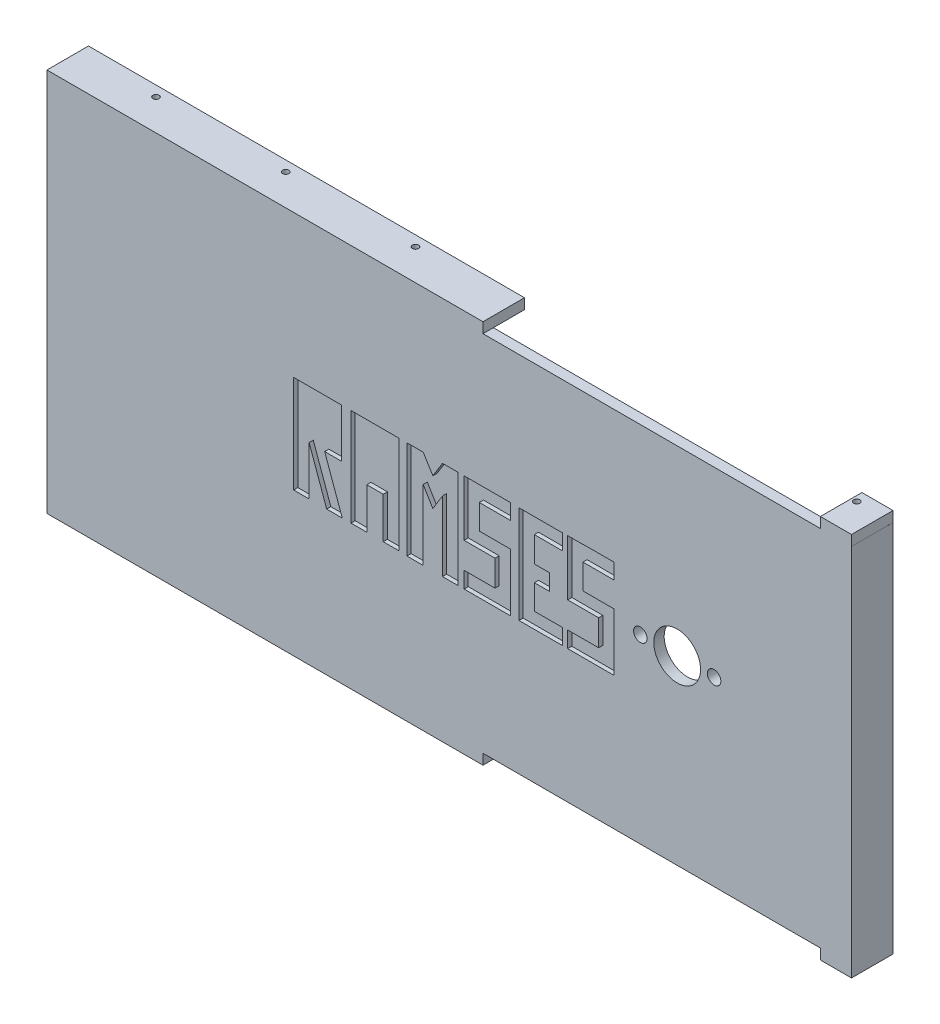
from build123d import *

# Parameters (mm, degrees)
SKETCH1_W               = 383.54
SKETCH1_H               = 228.6
BOSS_EXTRUDE1_DEPTH     = 5.08
CUT_EXTRUDE4_DEPTH      = 2.54
CUT_EXTRUDE4_DEPTH_BACK = 2.032
SKETCH3_W               = 7.551410014
SKETCH3_H               = 7.624040678
SKETCH3_W_2             = 8.426229182
SKETCH3_W_3             = 7.372950534
SKETCH3_H_2             = 8.377243284
SKETCH3_H_3             = 7.836309586
SKETCH3_H_4             = 23.885974754
SKETCH3_W_4             = 7.738672286
SKETCH3_W_5             = 8.057581655
SKETCH3_W_6             = 7.668237515
SKETCH3_H_5             = 12.138714326
SKETCH3_H_6             = 7.824594082
SKETCH3_H_7             = 20.136219216
SKETCH3_W_7             = 15.20808594
SKETCH3_H_8             = 7.579699467
SKETCH3_W_8             = 7.446662222
SKETCH3_W_9             = 13.868168861
SKETCH3_H_9             = 7.623435987
SKETCH3_H_10            = 12.134909421
SKETCH3_H_11            = 7.62
SKETCH3_W_10            = 7.699091451
SKETCH3_W_11            = 7.508994489
SKETCH3_H_12            = 12.721182216
SKETCH3_H_13            = 7.933797838
SKETCH3_W_12            = 15.145753673
SKETCH3_W_13            = 7.502078631
SKETCH3_W_14            = 7.480081761
SKETCH3_H_14            = 7.922088466
SKETCH3_H_15            = 7.672421885
SKETCH3_H_16            = 12.219933912
SKETCH3_H_17            = 7.494674976
SKETCH3_W_15            = 10.718331987
SKETCH3_H_18            = 7.528655491
SKETCH3_H_19            = 7.933797839
SKETCH3_W_16            = 3.019240536
SKETCH3_W_17            = 4.489753953
SKETCH3_H_20            = 12.727502234
SKETCH4_W               = 383.54
SKETCH4_H               = 25.463727846
SKETCH4_H_2             = 25.336272154
CUT_EXTRUDE5_DEPTH      = 6.35
SKETCH7_R               = 3.302
SKETCH7_R_2             = 11.43
CUT_EXTRUDE6_DEPTH      = 203.2
SKETCH8_W               = 15.24
SKETCH8_H               = 5.08
BOSS_EXTRUDE2_DEPTH     = 20.32
SKETCH11_R              = 1.5
CUT_EXTRUDE7_DEPTH      = 381


with BuildPart() as part:
    # Sketch1 → Boss-Extrude1 (new body)
    with BuildSketch(Plane.XY):
        Rectangle(SKETCH1_W, SKETCH1_H)
    extrude(amount=BOSS_EXTRUDE1_DEPTH)

    # Sketch3 → Cut-Extrude4 (cut, two sides: drawn at the far end of the back side and taken through both)
    with BuildSketch(Plane.XY.offset(5.08).offset(-CUT_EXTRUDE4_DEPTH_BACK)):
        with Locations((-72.346363981, 20.182774132)):
            Rectangle(SKETCH3_W, SKETCH3_H)
        with Locations((-64.357544383, 20.182774132)):
            Rectangle(SKETCH3_W_2, SKETCH3_H)
        with Locations((-56.457954525, 20.182774132)):
            Rectangle(SKETCH3_W_3, SKETCH3_H)
        with Locations((-56.457954525, 12.182132151)):
            Rectangle(SKETCH3_W_3, SKETCH3_H_2)
        with Locations((-72.346363981, 4.075355716)):
            Rectangle(SKETCH3_W, SKETCH3_H_3)
        with Locations((-72.346363981, -11.785786454)):
            Rectangle(SKETCH3_W, SKETCH3_H_4)
        with Locations((-72.346363981, 12.182132151)):
            Rectangle(SKETCH3_W, SKETCH3_H_2)
        with Locations((-64.357544383, 12.182132151)):
            Rectangle(SKETCH3_W_2, SKETCH3_H_2)
        Polygon((-68.570658974, 7.993510509), (-68.570658974, 0.157200923), (-60.950658974, 0.157200923), (-52.771479258, 0.157200923), (-52.771479258, 7.993510509), (-60.144429792, 7.993510509), align=None)
        Polygon((-68.570658974, 0.157200923), (-59.968883351, -23.728773831), (-52.348883351, -23.728773831), (-60.950658974, 0.157200923), align=None)
        with Locations((-44.220529343, 20.182774132)):
            Rectangle(SKETCH3_W_4, SKETCH3_H)
        with Locations((-36.322402373, 20.182774132)):
            Rectangle(SKETCH3_W_5, SKETCH3_H)
        with Locations((-28.459492788, 20.182774132)):
            Rectangle(SKETCH3_W_6, SKETCH3_H)
        with Locations((-28.459492788, 10.30139663)):
            Rectangle(SKETCH3_W_6, SKETCH3_H_5)
        with Locations((-36.322402373, 10.30139663)):
            Rectangle(SKETCH3_W_5, SKETCH3_H_5)
        with Locations((-44.220529343, 10.30139663)):
            Rectangle(SKETCH3_W_4, SKETCH3_H_5)
        with Locations((-44.220529343, 0.319742426)):
            Rectangle(SKETCH3_W_4, SKETCH3_H_6)
        with Locations((-36.322402373, 0.319742426)):
            Rectangle(SKETCH3_W_5, SKETCH3_H_6)
        Polygon((-24.62537403, 0.157200923), (-24.62537403, 4.232039467), (-32.293611545, 4.232039467), (-32.293611545, -3.592554615), (-24.62537403, -3.592554615), align=None)
        with Locations((-44.220529343, -13.660664223)):
            Rectangle(SKETCH3_W_4, SKETCH3_H_7)
        with Locations((-28.459492788, -13.660664223)):
            Rectangle(SKETCH3_W_6, SKETCH3_H_7)
        Polygon((-12.735071294, 23.994794471), (-20.70205372, 23.994794471), (-20.70205372, -23.994794471), (-12.735071294, -23.994794471), (-12.735071294, 10.313389338), align=None)
        Polygon((-8.004675478, 16.370753793), (-12.735071294, 23.994794471), (-12.735071294, 10.313389338), (-8.004675478, 2.426315091), (-3.274279663, 10.208504268), (-3.274279663, 23.994794471), align=None)
        Polygon((4.360745163, 23.994794471), (-3.274279663, 23.994794471), (-3.274279663, 10.208504268), (-3.274279663, -23.994794471), (4.360745163, -23.994794471), align=None)
        with Locations((22.317437477, 20.204944737)):
            Rectangle(SKETCH3_W_7, SKETCH3_H_8)
        with Locations((10.990063396, 20.204944737)):
            Rectangle(SKETCH3_W_8, SKETCH3_H_8)
        with Locations((48.563017268, 20.072456114)):
            Rectangle(SKETCH3_W_9, SKETCH3_H_9)
        with Locations((10.990063396, 10.347640294)):
            Rectangle(SKETCH3_W_8, SKETCH3_H_10)
        with Locations((10.990063396, 0.470185583)):
            Rectangle(SKETCH3_W_8, SKETCH3_H_11)
        with Locations((18.562940233, 0.470185583)):
            Rectangle(SKETCH3_W_10, SKETCH3_H_11)
        with Locations((26.166983202, 0.470185583)):
            Rectangle(SKETCH3_W_11, SKETCH3_H_11)
        with Locations((26.166983202, -9.700405525)):
            Rectangle(SKETCH3_W_11, SKETCH3_H_12)
        with Locations((26.166983202, -20.027895552)):
            Rectangle(SKETCH3_W_11, SKETCH3_H_13)
        with Locations((14.839609122, -20.027895552)):
            Rectangle(SKETCH3_W_12, SKETCH3_H_13)
        with Locations((37.877893521, 20.072456114)):
            Rectangle(SKETCH3_W_13, SKETCH3_H_9)
        Polygon((41.628932837, 16.26073812), (34.126854206, 16.26073812), (34.126854206, -16.215353517), (41.628932837, -16.215353517), (41.628932837, -4.115401118), (34.148851076, -4.115401118), (34.148851076, 3.806687348), (41.628932837, 3.806687348), align=None)
        with Locations((37.888891957, -0.154356885)):
            Rectangle(SKETCH3_W_14, SKETCH3_H_14)
        with Locations((45.368973717, -0.154356885)):
            Rectangle(SKETCH3_W_14, SKETCH3_H_14)
        with Locations((37.877893521, -20.051564459)):
            Rectangle(SKETCH3_W_13, SKETCH3_H_15)
        with Locations((48.563017268, -20.051564459)):
            Rectangle(SKETCH3_W_9, SKETCH3_H_15)
        with Locations((61.68040589, 10.390152539)):
            Rectangle(SKETCH3_W_8, SKETCH3_H_16)
        with Locations((61.68040589, 20.247456983)):
            Rectangle(SKETCH3_W_8, SKETCH3_H_17)
        with Locations((70.762902995, 20.247456983)):
            Rectangle(SKETCH3_W_15, SKETCH3_H_17)
        Polygon((65.403737001, 24.079818962), (65.403737001, 23.994794471), (76.122068988, 23.994794471), (76.122068988, 16.500119495), (80.611822941, 16.500119495), (80.611822941, 24.079818962), align=None)
        with Locations((61.68040589, 0.515857838)):
            Rectangle(SKETCH3_W_8, SKETCH3_H_18)
        with Locations((65.529951616, -19.942871061)):
            Rectangle(SKETCH3_W_12, SKETCH3_H_19)
        with Locations((69.253282727, 0.515857838)):
            Rectangle(SKETCH3_W_10, SKETCH3_H_18)
        with Locations((74.61244872, 0.515857838)):
            Rectangle(SKETCH3_W_16, SKETCH3_H_18)
        with Locations((78.366945965, 0.515857838)):
            Rectangle(SKETCH3_W_17, SKETCH3_H_18)
        with Locations((78.366945965, -9.612221025)):
            Rectangle(SKETCH3_W_17, SKETCH3_H_20)
        with Locations((74.61244872, -9.612221025)):
            Rectangle(SKETCH3_W_16, SKETCH3_H_20)
        with Locations((74.61244872, -19.942871061)):
            Rectangle(SKETCH3_W_16, SKETCH3_H_19)
        with Locations((78.366945965, -19.942871061)):
            Rectangle(SKETCH3_W_17, SKETCH3_H_19)
    extrude(amount=CUT_EXTRUDE4_DEPTH + CUT_EXTRUDE4_DEPTH_BACK, mode=Mode.SUBTRACT)

    # Sketch4 → Cut-Extrude5 (cut)
    with BuildSketch(Plane.XY.offset(5.08)):
        with Locations((0, 101.568136077)):
            Rectangle(SKETCH4_W, SKETCH4_H)
        with Locations((0, -101.631863923)):
            Rectangle(SKETCH4_W, SKETCH4_H_2)
    extrude(amount=-CUT_EXTRUDE5_DEPTH, mode=Mode.SUBTRACT)

    # Sketch7 → Cut-Extrude6 (cut)
    with BuildSketch(Plane.XY.offset(5.08)):
        with Locations((93.506776136, -0.23396958)):
            Circle(SKETCH7_R)
        with Locations((111.540776136, -0.23396958)):
            Circle(SKETCH7_R_2)
        with Locations((129.604477858, -0.23396958)):
            Circle(SKETCH7_R)
    extrude(amount=-CUT_EXTRUDE6_DEPTH, mode=Mode.SUBTRACT)

    # Sketch8 → Boss-Extrude2 (add)
    with BuildSketch(Plane.XY.offset(5.08)):
        Polygon((16.51, 93.916272154), (-196.85, 93.916272154), (-196.85, -94.043727846), (16.51, -94.043727846), (16.51, -88.963727846), (-191.77, -88.963727846), (-191.77, 88.836272154), (16.51, 88.836272154), align=None)
        with Locations((189.23, 91.376272154)):
            Rectangle(SKETCH8_W, SKETCH8_H)
        Polygon((196.85, 88.835766484), (191.77, 88.835766484), (191.77, -88.963727846), (181.61, -88.963727846), (181.61, -94.043727846), (196.85, -94.043727846), align=None)
    extrude(amount=-BOSS_EXTRUDE2_DEPTH)

    # Sketch11 → Cut-Extrude7 (cut)
    with BuildSketch(Plane.XZ.offset(94.043727846)):
        with Locations((-158.75, -10.16)):
            Circle(SKETCH11_R)
        with Locations((-95.25, -10.16)):
            Circle(SKETCH11_R)
        with Locations(Location((184.15, -10.16, 0), (0, 0, 270))):
            Circle(SKETCH11_R)
        with Locations((-31.75, -10.16)):
            Circle(SKETCH11_R)
    extrude(amount=-CUT_EXTRUDE7_DEPTH, mode=Mode.SUBTRACT)


solid = part.part
